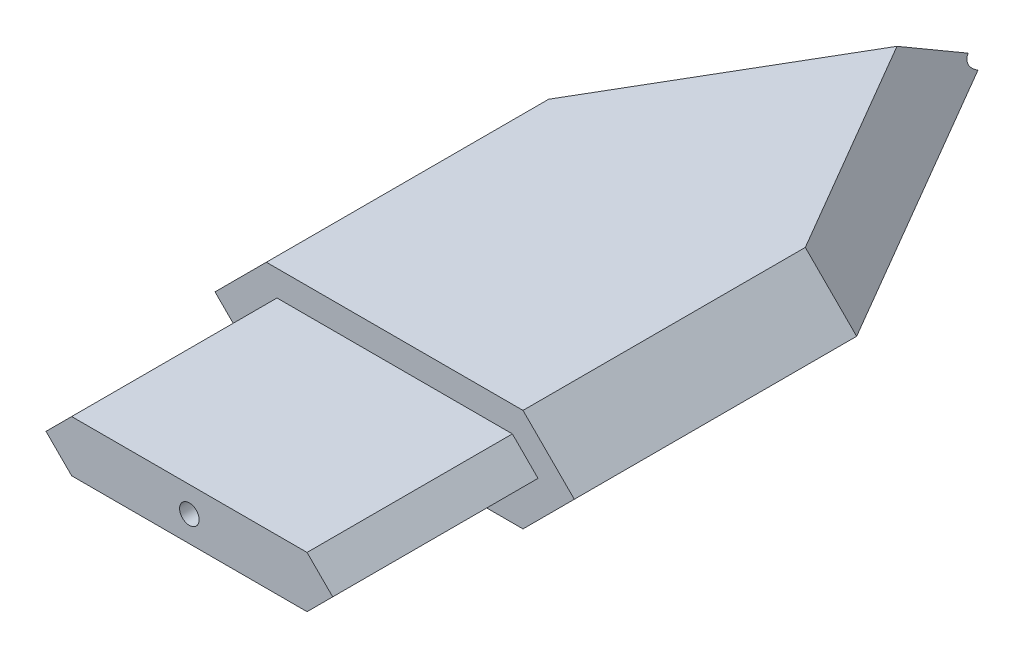
from build123d import *

# Parameters (mm, degrees)
EXTRUDE_1_DEPTH          = 18
CHAMFER_1_SIZE           = 5
CHAMFER_2_SIZE           = 5
CUT_EXTRUDE_1_DEPTH      = 8
EXTRUDE_2_REACH          = 696.741
EXTRUDE_2_END_RADIUS     = 240
EXTRUDE_3_DEPTH          = 5
EXTRUDE_4_REACH          = 929.644
EXTRUDE_4_END_RADIUS     = 232
SKETCH_10_R              = 12
CUT_EXTRUDE_7_DEPTH      = 695.872110635
CUT_EXTRUDE_7_DEPTH_BACK = 695.872110635
SKETCH_16_OUTSIDE_W      = 362.68
SKETCH_16_OUTSIDE_H      = 1204.68
SKETCH_16_OUTSIDE_W_2    = 100
SKETCH_16_OUTSIDE_H_2    = 155
SKETCH_21_R              = 1.9
CUT_EXTRUDE_17_DEPTH     = 160.216833407
SKETCH_34_OUTSIDE_W      = 105.66
SKETCH_34_OUTSIDE_H      = 55.66
CUT_EXTRUDE_18_DEPTH     = 40


with BuildPart() as part:
    # 草图4 → 放样1 section 0
    with BuildSketch(Plane(origin=(0, 10, 0), x_dir=(1, 0, 0), z_dir=(0, 1, 0))):
        with BuildLine():
            Line((25, 0), (-25, 0))
            Line((-25, 0), (-25, 630))
            Line((-25, 630), (0, 672.857142857))
            Line((0, 672.857142857), (25, 630))
            Line((25, 630), (25, 0))
        make_face()
    # 草图1 → 放样1 section 1
    with BuildSketch(Plane(origin=(0, 0, 0), x_dir=(1, 0, 0), z_dir=(0, 1, 0))):
        with BuildLine():
            Line((-35, 0), (35, 0))
            Line((35, 0), (35, 630))
            Line((35, 630), (0, 690))
            Line((0, 690), (-35, 630))
            Line((-35, 630), (-35, 0))
        make_face()
    loft_1 = loft()

    # 镜向1: 放样1 across plane
    add(loft_1.mirror(Plane.ZX))



with BuildPart() as body_2:
    # 草图5 → 凸台-拉伸1 (new, symmetric)
    with BuildSketch(Plane(origin=(0, 0, 0), x_dir=(1, 0, 0), z_dir=(0, 1, 0))):
        with BuildLine():
            ThreePointArc((-66.346774613, -65.189169183), (0, -55.5), (66.346774613, -65.189169183))
            ThreePointArc((66.346774613, -65.189169183), (73.061224406, -64.270510235), (76.791165228, -58.612302768))
            ThreePointArc((76.791165228, -58.612302768), (79, -30.5), (76.791165228, -2.387697232))
            ThreePointArc((76.791165228, -2.387697232), (0, -15.004503167), (-76.791165228, -2.387697232))
            ThreePointArc((-76.791165228, -2.387697232), (-79, -30.5), (-76.791165228, -58.612302768))
            ThreePointArc((-76.791165228, -58.612302768), (-73.061224406, -64.270510235), (-66.346774613, -65.189169183))
        make_face()
    extrude(amount=EXTRUDE_1_DEPTH, both=True)

    # 倒角1
    chamfer_1_edges = [body_2.edges().sort_by_distance(p)[0] for p in [
        (0, 18, 15.004503167),
        (-79, 18, 30.5),
        (-73.061224406, 18, 64.270510235),
        (0, 18, 55.5),
        (73.061224406, 18, 64.270510235),
        (0, -18, 55.5),
        (-73.061224406, -18, 64.270510235),
        (-79, -18, 30.5),
        (79, -18, 30.5),
        (73.061224406, -18, 64.270510235),
        (79, 18, 30.5),
    ]]
    chamfer(chamfer_1_edges, length=CHAMFER_1_SIZE)

    # 倒角2
    chamfer_2_edges = [body_2.edges().sort_by_distance(p)[0] for p in [
        (0, -18, 15.004503167),
    ]]
    chamfer(chamfer_2_edges, length=CHAMFER_2_SIZE)

    # 草图6 → 切除-拉伸1 (cut)
    with BuildSketch(Plane(origin=(0, 18, 0), x_dir=(1, 0, 0), z_dir=(0, 1, 0))):
        with BuildLine():
            ThreePointArc((67.221840199, -55.023712607), (68.932610365, -35.286223394), (68.335500378, -15.483731767))
            ThreePointArc((68.335500378, -15.483731767), (0, -25.004503167), (-68.335500378, -15.483731767))
            ThreePointArc((-68.335500378, -15.483731767), (-68.932610365, -35.286223394), (-67.221840199, -55.023712607))
            ThreePointArc((-67.221840199, -55.023712607), (0, -45.5), (67.221840199, -55.023712607))
        make_face()
    cut_extrude_1 = extrude(amount=-CUT_EXTRUDE_1_DEPTH, mode=Mode.SUBTRACT)

    # 镜向2: 切除-拉伸1 across plane
    add(cut_extrude_1.mirror(Plane.ZX), mode=Mode.SUBTRACT)


with BuildPart() as part_1:
    add(part.part)

    add(body_2.part)  # 凸台-拉伸2 merges body 2
    # 凸台-拉伸2: up to this cylinder (the profile starts inside it)
    extrude_2_end = Plane(origin=(0, 0, -224.995496833), z_dir=(0, -1, 0)) * Cylinder(EXTRUDE_2_END_RADIUS, 1874.482, mode=Mode.PRIVATE)
    # 草图7 → 凸台-拉伸2 (add, up to the surface)
    with BuildSketch(Plane.XY, mode=Mode.PRIVATE) as extrude_2_sk1:
        Polygon((-25.828427125, 12), (-37.828427125, 0), (-25.828427125, -12), (25.828427125, -12), (37.828427125, 0), (25.828427125, 12), align=None)
    extrude_2_tool1 = extrude(extrude_2_sk1.sketch, amount=EXTRUDE_2_REACH, mode=Mode.PRIVATE) & extrude_2_end
    add(extrude_2_tool1.solids().sort_by_distance((0, 0, 0))[0])

    # 草图8 → 凸台-拉伸3 (add)
    with BuildSketch(Plane(origin=(0, 0, 0), x_dir=(-1, 0, 0), z_dir=(0, 0, -1))):
        Polygon((25.828427125, 12), (-25.828427125, 12), (-37.828427125, 0), (-25.828427125, -12), (25.828427125, -12), (37.828427125, 0), align=None)
    extrude(amount=EXTRUDE_3_DEPTH)



with BuildPart() as body_2_2:
    # 草图9 → 旋转1 (revolve)
    with BuildSketch(Plane(origin=(0, 0, 0), x_dir=(1, 0, 0), z_dir=(0, 1, 0))):
        Polygon((0, -310), (0, -234), (-12, -234), (-22.5, -256), align=None)
    revolve(axis=Axis((0, 0, -690), (0, 0, 1)))


with BuildPart() as part_2:
    add(part_1.part)

    add(body_2_2.part)  # 凸台-拉伸4 merges body 2 2
    # 凸台-拉伸4: up to this cylinder (the profile starts inside it)
    extrude_4_end = Plane(origin=(0, 0, 287.5), z_dir=(0, -1, 0)) * Cylinder(EXTRUDE_4_END_RADIUS, 2324.288, mode=Mode.PRIVATE)
    # 草图10 → 凸台-拉伸4 (add, up to the surface)
    with BuildSketch(Plane(origin=(0, 0, 234), x_dir=(-1, 0, 0), z_dir=(0, 0, -1)), mode=Mode.PRIVATE) as extrude_4_sk1:
        with Locations(Location((0, 0, 0), (0, 0, 90))):
            Circle(SKETCH_10_R)
    extrude_4_tool1 = extrude(extrude_4_sk1.sketch, amount=EXTRUDE_4_REACH, mode=Mode.PRIVATE) & extrude_4_end
    add(extrude_4_tool1.solids().sort_by_distance((0, 0, 234))[0])

    # 草图16 outside → 切除-拉伸7 (cut, two sides: drawn at the far end of the back side and taken through both)
    with BuildSketch(Plane(origin=(0, 0, 0), x_dir=(1, 0, 0), z_dir=(0, 1, 0)).offset(-CUT_EXTRUDE_7_DEPTH_BACK)):
        with Locations((0, 190)):
            Rectangle(SKETCH_16_OUTSIDE_W, SKETCH_16_OUTSIDE_H)
        with Locations((0, 612.5)):
            Rectangle(SKETCH_16_OUTSIDE_W_2, SKETCH_16_OUTSIDE_H_2, mode=Mode.SUBTRACT)
    extrude(amount=CUT_EXTRUDE_7_DEPTH + CUT_EXTRUDE_7_DEPTH_BACK, mode=Mode.SUBTRACT)

    # 草图21 → 切除-拉伸17 (cut, through all)
    with BuildSketch(Plane.XY.offset(-535)):
        Circle(SKETCH_21_R)
    extrude(amount=-CUT_EXTRUDE_17_DEPTH, mode=Mode.SUBTRACT)

    # 草图34 outside → 切除-拉伸18 (cut)
    with BuildSketch(Plane.XY.offset(-535)):
        Rectangle(SKETCH_34_OUTSIDE_W, SKETCH_34_OUTSIDE_H)
        Polygon((-22.928932188, -5), (22.928932188, -5), (27.928932188, 0), (22.928932188, 5), (-22.928932188, 5), (-27.928932188, 0), align=None, mode=Mode.SUBTRACT)
    extrude(amount=-CUT_EXTRUDE_18_DEPTH, mode=Mode.SUBTRACT)


solid = part_2.part
